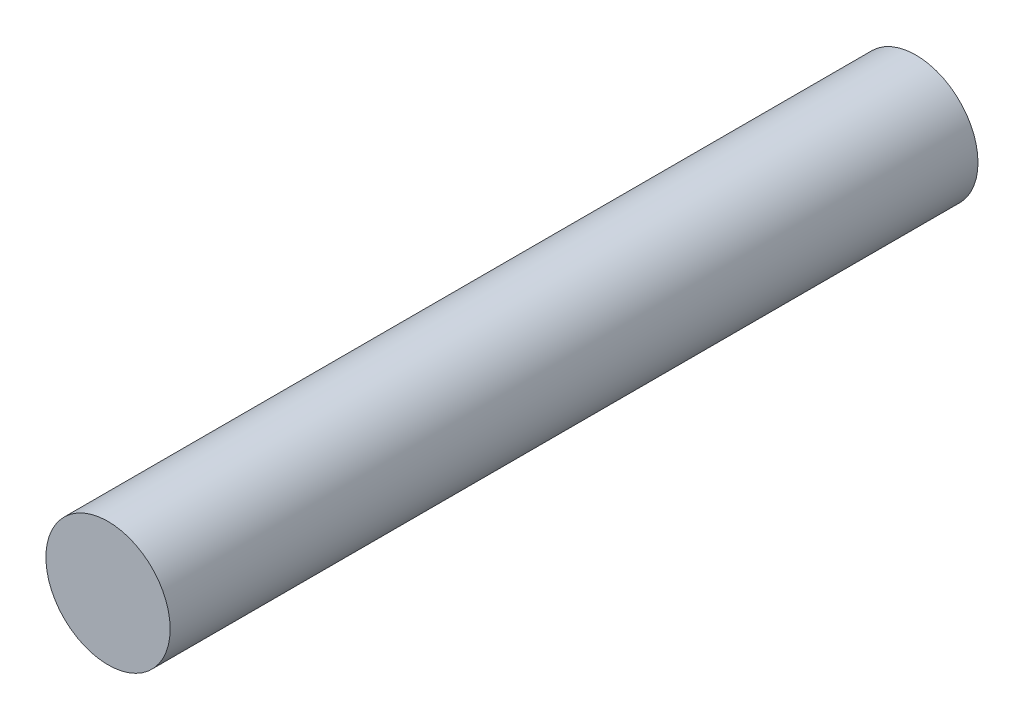
from build123d import *

# Parameters (mm, degrees)
SKETCH1_R           = 3.175
BOSS_EXTRUDE1_DEPTH = 41.275


with BuildPart() as part:
    # Sketch1 → Boss-Extrude1 (new body)
    with BuildSketch(Plane.XY):
        Circle(SKETCH1_R)
    extrude(amount=BOSS_EXTRUDE1_DEPTH)


solid = part.part
